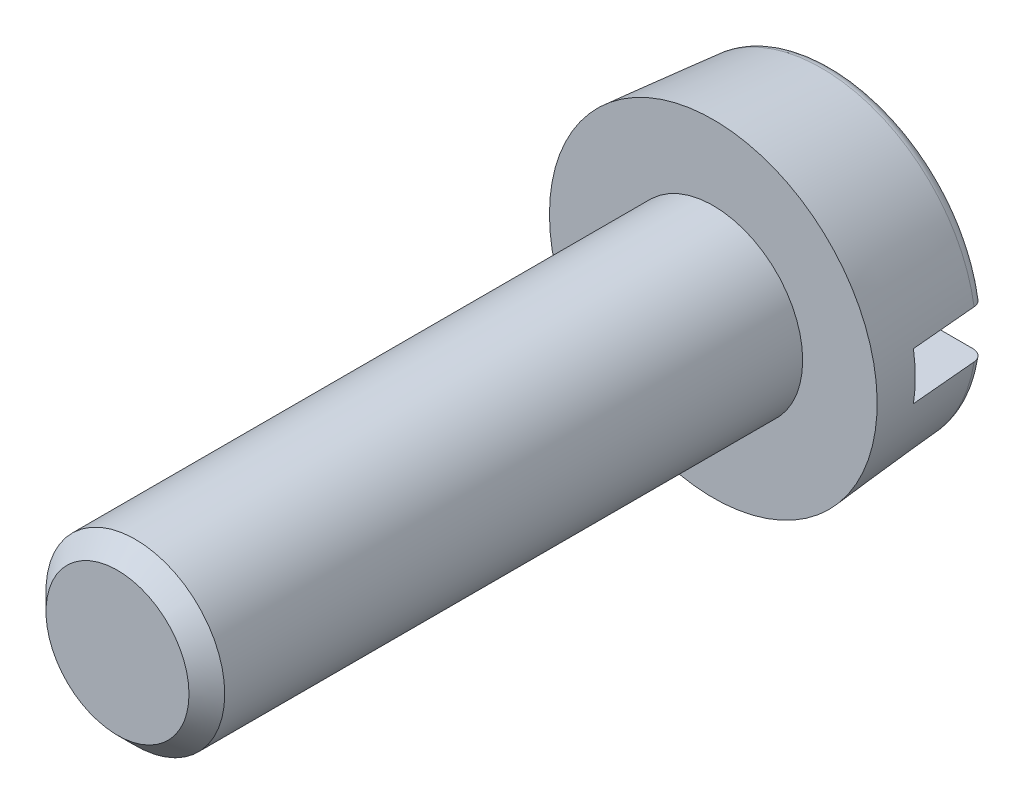
from build123d import *

# Parameters (mm, degrees)
ESQUISSE2_W             = 5.5
ESQUISSE2_H             = 0.8
ENLEV_MAT_EXTRU_1_DEPTH = 1.3
ESQUISSE3_W             = 1.5
ESQUISSE3_H             = 10
CHANFREIN1_SIZE         = 0.3


with BuildPart() as part:
    # Esquisse1 → Base-Révolution (revolve)
    with BuildSketch(Plane(origin=(0, 0, 0), x_dir=(1, 0, 0), z_dir=(0, 1, 0))):
        with BuildLine():
            Line((0, 0), (2.75, 0))
            Line((2.75, 0), (2.590995378, 1.817431149))
            ThreePointArc((2.590995378, 1.817431149), (2.52687448, 1.947455467), (2.391756438, 2))
            Line((2.391756438, 2), (0, 2))
            Line((0, 2), (0, 0))
        make_face()
    revolve(axis=Axis((0, 0, 0), (0, 0, -1)))

    # Esquisse2 → Enlev. mat.-Extru.1 (cut)
    with BuildSketch(Plane.XY.offset(-2)):
        Rectangle(ESQUISSE2_W, ESQUISSE2_H)
    extrude(amount=ENLEV_MAT_EXTRU_1_DEPTH, mode=Mode.SUBTRACT)

    # Esquisse3 → Boss.-Révol.1 (revolve)
    with BuildSketch(Plane(origin=(0, 0, 0), x_dir=(1, 0, 0), z_dir=(0, 1, 0))):
        with Locations((0.75, -5)):
            Rectangle(ESQUISSE3_W, ESQUISSE3_H)
    revolve(axis=Axis((0, 0, 0), (0, 0, 1)))

    # Chanfrein1
    chanfrein1_edges = [part.edges().sort_by_distance(p)[0] for p in [
        (-1.5, 0, 10),
    ]]
    chamfer(chanfrein1_edges, length=CHANFREIN1_SIZE)


solid = part.part
